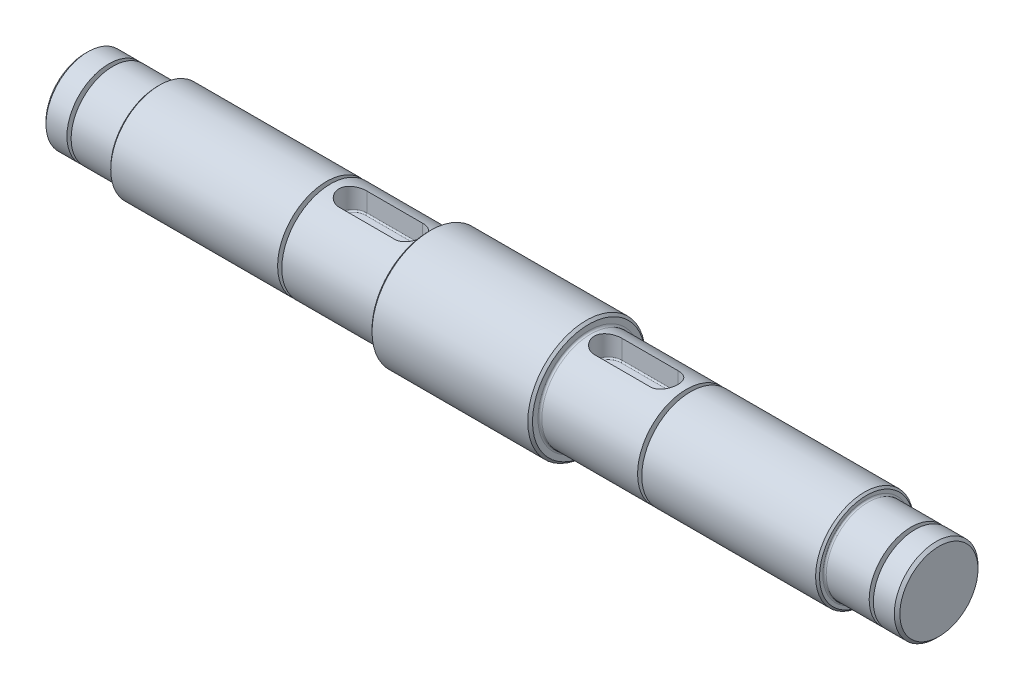
from build123d import *

# Parameters (mm, degrees)
SKETCH2_R           = 15
BOSS_EXTRUDE1_DEPTH = 10
SKETCH4_W           = 1.5
SKETCH4_H           = 3.5
SKETCH5_R           = 15
BOSS_EXTRUDE2_DEPTH = 10
SKETCH6_W           = 1.5
SKETCH6_H           = 3.5
CUT_EXTRUDE1_DEPTH  = 20
CUT_EXTRUDE2_START  = 20
CUT_EXTRUDE2_DEPTH  = 20
FILLET5_R           = 0.6
CHAMFER1_SIZE       = 0.7
FILLET6_R           = 0.7
CHAMFER2_SIZE       = 0.84
FILLET7_R           = 0.7
CHAMFER3_SIZE       = 0.84
CHAMFER4_SIZE       = 0.7
FILLET8_R           = 0.6
CUT_EXTRUDE3_DEPTH  = 8
CUT_EXTRUDE4_DEPTH  = 8
FILLET9_R           = 0.4
FILLET10_R          = 0.4
FILLET11_R          = 0.4
FILLET12_R          = 0.4
FILLET13_R          = 0.5
CHAMFER5_SIZE       = 1
CHAMFER6_SIZE       = 1


with BuildPart() as part:
    # Sketch1 → Revolve1 (revolve)
    with BuildSketch(Plane.XY, mode=Mode.PRIVATE) as revolve1_sk:
        Polygon((-143, 0), (-143, 15), (-127, 15), (-127, 17.5), (-66.5, 17.5), (-66.5, 13.6), (-65, 13.6), (-65, 17.5), (-30, 17.5), (-30, 21), (27.5, 21), (27.5, 17.5), (62.5, 17.5), (62.5, 13.6), (64, 13.6), (64, 17.5), (127, 17.5), (127, 15), (143, 15), (143, 0), align=None)
    revolve(revolve1_sk.sketch.rotate(Axis((-143, 0, 0), (1, 0, 0)), 90), axis=Axis((-143, 0, 0), (1, 0, 0)))

    # Sketch7 → Cut-Extrude1 (cut)
    with BuildSketch(Plane.ZY.offset(37)):
        with BuildLine():
            Line((-5, 9.5), (5, 9.5))
            Line((5, 9.5), (5, 16.770509831))
            ThreePointArc((5, 16.770509831), (0, 17.5), (-5, 16.770509831))
            Line((-5, 16.770509831), (-5, 9.5))
        make_face()
    extrude(amount=CUT_EXTRUDE1_DEPTH, mode=Mode.SUBTRACT)

    # Sketch8 → Cut-Extrude2 (cut)
    with BuildSketch(Plane(origin=(34.5, 0, 0), x_dir=(0, 0, -1), z_dir=(1, 0, 0)).offset(CUT_EXTRUDE2_START)):
        with BuildLine():
            Line((-5, 9.5), (5, 9.5))
            Line((5, 9.5), (5, 16.770509831))
            ThreePointArc((5, 16.770509831), (0, 17.5), (-5, 16.770509831))
            Line((-5, 16.770509831), (-5, 9.5))
        make_face()
    extrude(amount=-CUT_EXTRUDE2_DEPTH, mode=Mode.SUBTRACT)

    # Fillet5
    fillet5_edges = [part.edges().sort_by_distance(p)[0] for p in [
        (-127, 0, -15),
    ]]
    fillet(fillet5_edges, radius=FILLET5_R)

    # Chamfer1
    chamfer1_edges = [part.edges().sort_by_distance(p)[0] for p in [
        (-127, 0, -17.5),
    ]]
    chamfer(chamfer1_edges, length=CHAMFER1_SIZE)

    # Fillet6
    fillet6_edges = [part.edges().sort_by_distance(p)[0] for p in [
        (-30, 0, -17.5),
    ]]
    fillet(fillet6_edges, radius=FILLET6_R)

    # Chamfer2
    chamfer2_edges = [part.edges().sort_by_distance(p)[0] for p in [
        (-30, 0, -21),
    ]]
    chamfer(chamfer2_edges, length=CHAMFER2_SIZE)

    # Fillet7
    fillet7_edges = [part.edges().sort_by_distance(p)[0] for p in [
        (27.5, 0, -17.5),
    ]]
    fillet(fillet7_edges, radius=FILLET7_R)

    # Chamfer3
    chamfer3_edges = [part.edges().sort_by_distance(p)[0] for p in [
        (27.5, 0, -21),
    ]]
    chamfer(chamfer3_edges, length=CHAMFER3_SIZE)

    # Chamfer4
    chamfer4_edges = [part.edges().sort_by_distance(p)[0] for p in [
        (127, 0, -17.5),
    ]]
    chamfer(chamfer4_edges, length=CHAMFER4_SIZE)

    # Fillet8
    fillet8_edges = [part.edges().sort_by_distance(p)[0] for p in [
        (127, 0, -15),
    ]]
    fillet(fillet8_edges, radius=FILLET8_R)

    # Sketch10 → Cut-Extrude3 (cut)
    with BuildSketch(Plane(origin=(0, 17.5, 0), x_dir=(1, 0, 0), z_dir=(0, 1, 0))):
        with BuildLine():
            Line((-57, 5), (-57, -5))
            ThreePointArc((-57, -5), (-62, 0), (-57, 5))
        make_face()
        with BuildLine():
            Line((-37, 5), (-37, -5))
            ThreePointArc((-37, -5), (-32, 0), (-37, 5))
        make_face()
    extrude(amount=-CUT_EXTRUDE3_DEPTH, mode=Mode.SUBTRACT)

    # Sketch11 → Cut-Extrude4 (cut)
    with BuildSketch(Plane(origin=(0, 17.5, 0), x_dir=(1, 0, 0), z_dir=(0, 1, 0))):
        with BuildLine():
            Line((34.5, 5), (34.5, -5))
            ThreePointArc((34.5, -5), (29.5, 0), (34.5, 5))
        make_face()
        with BuildLine():
            Line((54.5, 5), (54.5, -5))
            ThreePointArc((54.5, -5), (59.5, 0), (54.5, 5))
        make_face()
    extrude(amount=-CUT_EXTRUDE4_DEPTH, mode=Mode.SUBTRACT)



with BuildPart() as body_2:
    # Sketch2 → Boss-Extrude1 (new body)
    with BuildSketch(Plane.ZY.offset(143)):
        Circle(SKETCH2_R)
    extrude(amount=BOSS_EXTRUDE1_DEPTH)

    # Sketch4 → Cut-Revolve1 (revolve, cut)
    with BuildSketch(Plane.XY, mode=Mode.PRIVATE) as cut_revolve1_sk:
        with Locations((-143.75, 13.25)):
            Rectangle(SKETCH4_W, SKETCH4_H)
    revolve(cut_revolve1_sk.sketch.rotate(Axis((-153, 0, 0), (1, 0, 0)), 90), axis=Axis((-153, 0, 0), (1, 0, 0)), mode=Mode.SUBTRACT)

    # Fillet12
    fillet12_edges = [body_2.edges().sort_by_distance(p)[0] for p in [
        (-144.5, 0, -11.5),
    ]]
    fillet(fillet12_edges, radius=FILLET12_R)


with BuildPart() as body_3:
    # Sketch5 → Boss-Extrude2 (new body)
    with BuildSketch(Plane(origin=(143, 0, 0), x_dir=(0, 0, -1), z_dir=(1, 0, 0))):
        with Locations(Location((0, 0, 0), (0, 0, 180))):
            Circle(SKETCH5_R)
    extrude(amount=BOSS_EXTRUDE2_DEPTH)

    # Sketch6 → Cut-Revolve2 (revolve, cut)
    with BuildSketch(Plane.XY, mode=Mode.PRIVATE) as cut_revolve2_sk:
        with Locations((143.75, 13.25)):
            Rectangle(SKETCH6_W, SKETCH6_H)
    revolve(cut_revolve2_sk.sketch.rotate(Axis((-153, 0, 0), (1, 0, 0)), 90), axis=Axis((-153, 0, 0), (1, 0, 0)), mode=Mode.SUBTRACT)

    # Fillet9
    fillet9_edges = [body_3.edges().sort_by_distance(p)[0] for p in [
        (144.5, 0, -11.5),
    ]]
    fillet(fillet9_edges, radius=FILLET9_R)


with BuildPart() as part_1:
    add(part.part)

    add(body_3.part)  # Revolve2 merges body 3
    # Sketch12 → Revolve2 (revolve)
    with BuildSketch(Plane.XY, mode=Mode.PRIVATE) as revolve2_sk:
        with BuildLine():
            Line((143, 11.9), (143, 11.5))
            Line((143, 11.5), (143.4, 11.5))
            ThreePointArc((143.4, 11.5), (143.117157288, 11.617157288), (143, 11.9))
        make_face()
    revolve(revolve2_sk.sketch.rotate(Axis((153, 0, 0), (-1, 0, 0)), 90), axis=Axis((153, 0, 0), (-1, 0, 0)))

    # Fillet10
    fillet10_edges = [part_1.edges().sort_by_distance(p)[0] for p in [
        (62.5, 0, -13.6),
        (64, 0, -13.6),
    ]]
    fillet(fillet10_edges, radius=FILLET10_R)

    # Fillet11
    fillet11_edges = [part_1.edges().sort_by_distance(p)[0] for p in [
        (-66.5, 0, -13.6),
        (-65, 0, -13.6),
    ]]
    fillet(fillet11_edges, radius=FILLET11_R)


    add(body_2.part)  # Revolve3 merges body 2
    # Sketch13 → Revolve3 (revolve)
    with BuildSketch(Plane.XY, mode=Mode.PRIVATE) as revolve3_sk:
        with BuildLine():
            Line((-143.4, 11.5), (-143, 11.5))
            Line((-143, 11.5), (-143, 11.9))
            ThreePointArc((-143, 11.9), (-143.117157288, 11.617157288), (-143.4, 11.5))
        make_face()
    revolve(revolve3_sk.sketch.rotate(Axis((-153, 0, 0), (1, 0, 0)), 270), axis=Axis((-153, 0, 0), (1, 0, 0)))

    # Fillet13
    fillet13_edges = [part_1.edges().sort_by_distance(p)[0] for p in [
        (-47, 9.5, -5),
        (-47, 9.5, 5),
        (44.5, 9.5, 5),
        (44.5, 9.5, -5),
        (-32, 9.5, 0),
        (-62, 9.5, 0),
        (29.5, 9.5, 0),
        (59.5, 9.5, 0),
    ]]
    fillet(fillet13_edges, radius=FILLET13_R)

    # Chamfer5
    chamfer5_edges = [part_1.edges().sort_by_distance(p)[0] for p in [
        (153, 0, -15),
    ]]
    chamfer(chamfer5_edges, length=CHAMFER5_SIZE)

    # Chamfer6
    chamfer6_edges = [part_1.edges().sort_by_distance(p)[0] for p in [
        (-153, 0, -15),
    ]]
    chamfer(chamfer6_edges, length=CHAMFER6_SIZE)


solid = part_1.part
